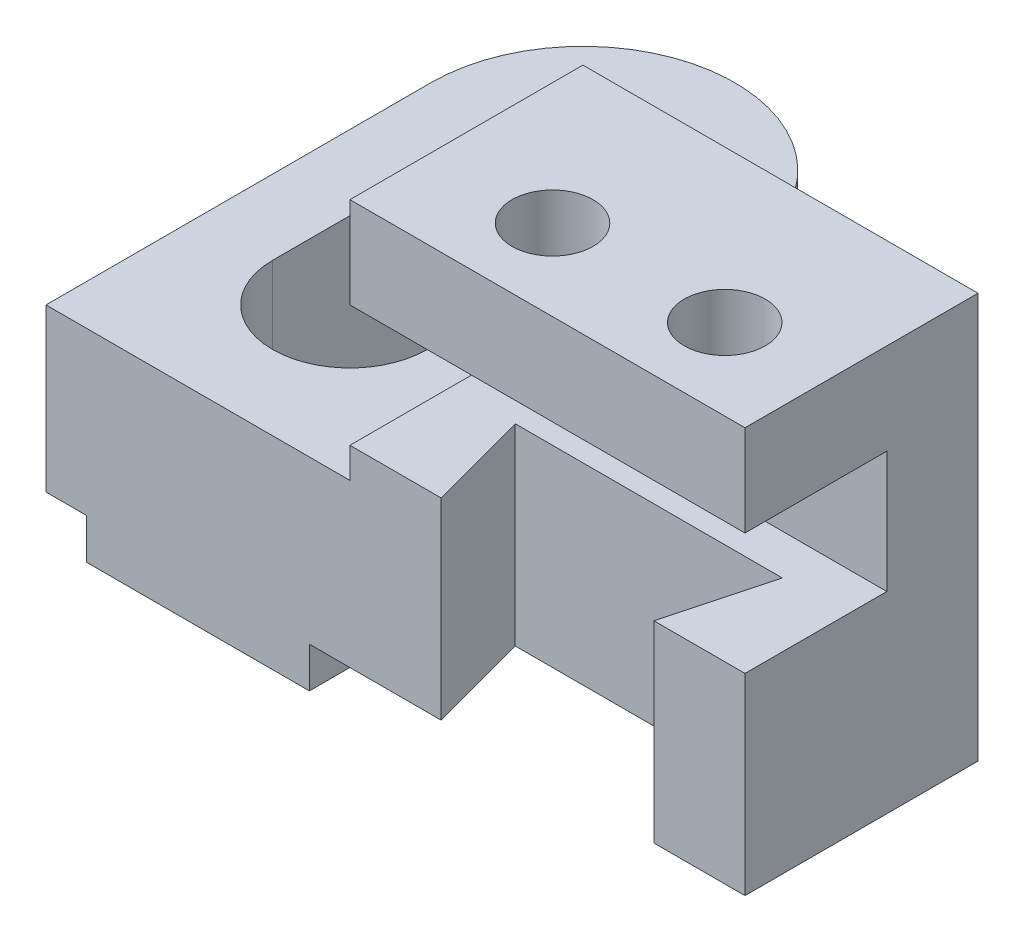
from build123d import *

# Parameters (mm, degrees)
BOSS_EXTRUDE1_DEPTH = 16
BOSS_EXTRUDE2_DEPTH = 39
SKETCH5_R           = 4
CUT_EXTRUDE1_DEPTH  = 9
SKETCH7_W           = 39
SKETCH7_H           = 16
BOSS_EXTRUDE3_DEPTH = 23
CUT_EXTRUDE2_DEPTH  = 23
SKETCH10_W          = 22
SKETCH10_H          = 4
BOSS_EXTRUDE4_DEPTH = 5


with BuildPart() as part:
    # Sketch2 → Boss-Extrude1 (new body)
    with BuildSketch(Plane(origin=(0, 0, 0), x_dir=(1, 0, 0), z_dir=(0, 1, 0))):
        with BuildLine():
            Line((-15, 43.410987083), (-15, 5.410987083))
            Line((-15, 5.410987083), (15, 5.410987083))
            Line((15, 5.410987083), (15, 43.410987083))
            Line((15, 43.410987083), (7.630797424, 43.410987083))
            Line((7.630797424, 43.410987083), (7.630797424, 20.410987083))
            ThreePointArc((7.630797424, 20.410987083), (0, 12.780189659), (-7.630797424, 20.410987083))
            Line((-7.630797424, 20.410987083), (-7.630797424, 43.410987083))
            Line((-7.630797424, 43.410987083), (-15, 43.410987083))
        make_face()
        with BuildLine():
            ThreePointArc((15, 43.410987083), (0, 58.410987083), (-15, 43.410987083))
            Line((-15, 43.410987083), (-7.630797424, 43.410987083))
            ThreePointArc((-7.630797424, 43.410987083), (0, 51.041784507), (7.630797424, 43.410987083))
            Line((7.630797424, 43.410987083), (15, 43.410987083))
        make_face()
    extrude(amount=-BOSS_EXTRUDE1_DEPTH)



with BuildPart() as body_2:
    # Sketch4 → Boss-Extrude2 (new body)
    with BuildSketch(Plane(origin=(15, 0, 0), x_dir=(0, 0, -1), z_dir=(1, 0, 0))):
        Polygon((5.410987083, 24), (5.410987083, 15), (19.410987083, 15), (19.410987083, 3), (5.410987083, 3), (5.410987083, 0), (28.410987083, 0), (28.410987083, 24), align=None)
    extrude(amount=BOSS_EXTRUDE2_DEPTH)

    # Sketch5 → Cut-Extrude1 (cut)
    with BuildSketch(Plane(origin=(0, 24, 0), x_dir=(1, 0, 0), z_dir=(0, 1, 0))):
        with Locations(Location((27, 13.410987083, 0), (0, 0, 270))):
            Circle(SKETCH5_R)
        with Locations(Location((44, 13.410987083, 0), (0, 0, 270))):
            Circle(SKETCH5_R)
    extrude(amount=-CUT_EXTRUDE1_DEPTH, mode=Mode.SUBTRACT)


with BuildPart() as part_1:
    add(part.part)

    add(body_2.part)  # Boss-Extrude3 merges body 2
    # Sketch7 → Boss-Extrude3 (add)
    with BuildSketch(Plane.XY.offset(-5.410987083)):
        with Locations((34.5, -8)):
            Rectangle(SKETCH7_W, SKETCH7_H)
    extrude(amount=-BOSS_EXTRUDE3_DEPTH)

    # Sketch9 → Cut-Extrude2 (cut)
    with BuildSketch(Plane(origin=(0, 3, 0), x_dir=(1, 0, 0), z_dir=(0, 1, 0))):
        Polygon((21.320508076, 15.410987083), (24, 5.410987083), (45, 5.410987083), (47.679491924, 15.410987083), align=None)
    extrude(amount=-CUT_EXTRUDE2_DEPTH, mode=Mode.SUBTRACT)

    # Sketch10 → Boss-Extrude4 (add)
    with BuildSketch(Plane.XY.offset(-5.410987083)):
        with Locations((0, -18)):
            Rectangle(SKETCH10_W, SKETCH10_H)
    extrude(amount=-BOSS_EXTRUDE4_DEPTH)


solid = part_1.part
